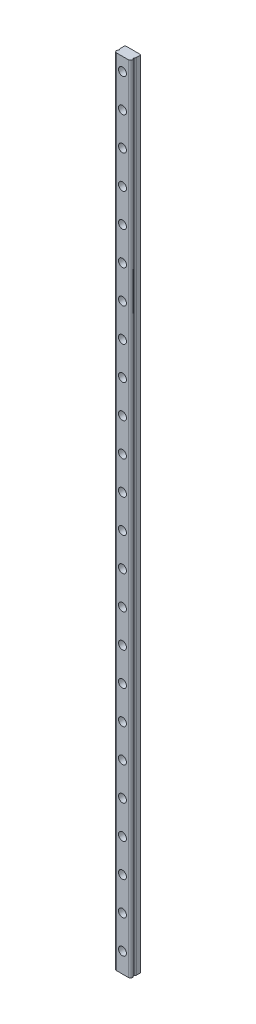
from build123d import *

# Parameters (mm, degrees)
SKETCH1_W           = 12
SKETCH1_H           = 600
BOSS_EXTRUDE1_DEPTH = 8
CUT_EXTRUDE1_DEPTH  = 601.083327547
SKETCH3_R           = 3
CUT_EXTRUDE2_DEPTH  = 4.5
SKETCH4_R           = 1.75
CUT_EXTRUDE3_DEPTH  = 601.046873169
LPATTERN1_COUNT     = 24
LPATTERN1_PITCH     = 25


with BuildPart() as part:
    # Sketch1 → Boss-Extrude1 (new body)
    with BuildSketch(Plane.XY):
        with Locations((0, 300)):
            Rectangle(SKETCH1_W, SKETCH1_H)
    extrude(amount=BOSS_EXTRUDE1_DEPTH)

    # Sketch2 → Cut-Extrude1 (cut, through all)
    with BuildSketch(Plane(origin=(0, 600, 0), x_dir=(1, 0, 0), z_dir=(0, 1, 0))):
        with BuildLine():
            Line((-5.5, 0), (-6, -0.5))
            Line((-6, -0.5), (-6, -3.5))
            ThreePointArc((-6, -3.5), (-5.867156742, -4.117156742), (-5.492156742, -4.625))
            ThreePointArc((-5.492156742, -4.625), (-5.322875656, -5), (-5.492156742, -5.375))
            ThreePointArc((-5.492156742, -5.375), (-5.90312152, -7.030330086), (-4.5, -8))
            Line((-4.5, -8), (-7.760322007, -8))
            Line((-7.760322007, -8), (-7.760322007, 0))
            Line((-7.760322007, 0), (-5.5, 0))
        make_face()
        with BuildLine():
            Line((6, -0.5), (6, -3.5))
            ThreePointArc((6, -3.5), (5.867156742, -4.117156742), (5.492156742, -4.625))
            ThreePointArc((5.492156742, -4.625), (5.322875656, -5), (5.492156742, -5.375))
            ThreePointArc((5.492156742, -5.375), (5.90312152, -7.030330086), (4.5, -8))
            Line((4.5, -8), (7.760322007, -8))
            Line((7.760322007, -8), (7.760322007, 0))
            Line((7.760322007, 0), (5.5, 0))
            Line((5.5, 0), (6, -0.5))
        make_face()
    extrude(amount=-CUT_EXTRUDE1_DEPTH, mode=Mode.SUBTRACT)

    # Sketch3 → Cut-Extrude2 (cut)
    with BuildSketch(Plane.XY.offset(8)):
        with Locations((0, 590)):
            Circle(SKETCH3_R)
    cut_extrude2 = extrude(amount=-CUT_EXTRUDE2_DEPTH, mode=Mode.SUBTRACT)

    # Sketch4 → Cut-Extrude3 (cut, through all)
    with BuildSketch(Plane.XY.offset(3.5)):
        with Locations((0, 590)):
            Circle(SKETCH4_R)
    cut_extrude3 = extrude(amount=-CUT_EXTRUDE3_DEPTH, mode=Mode.SUBTRACT)

    # LPattern1: Cut-Extrude2, Cut-Extrude3 ×24
    with Locations(*[(0, -i * LPATTERN1_PITCH, 0) for i in range(1, LPATTERN1_COUNT)]):
        add(cut_extrude2, mode=Mode.SUBTRACT)
        add(cut_extrude3, mode=Mode.SUBTRACT)


solid = part.part
